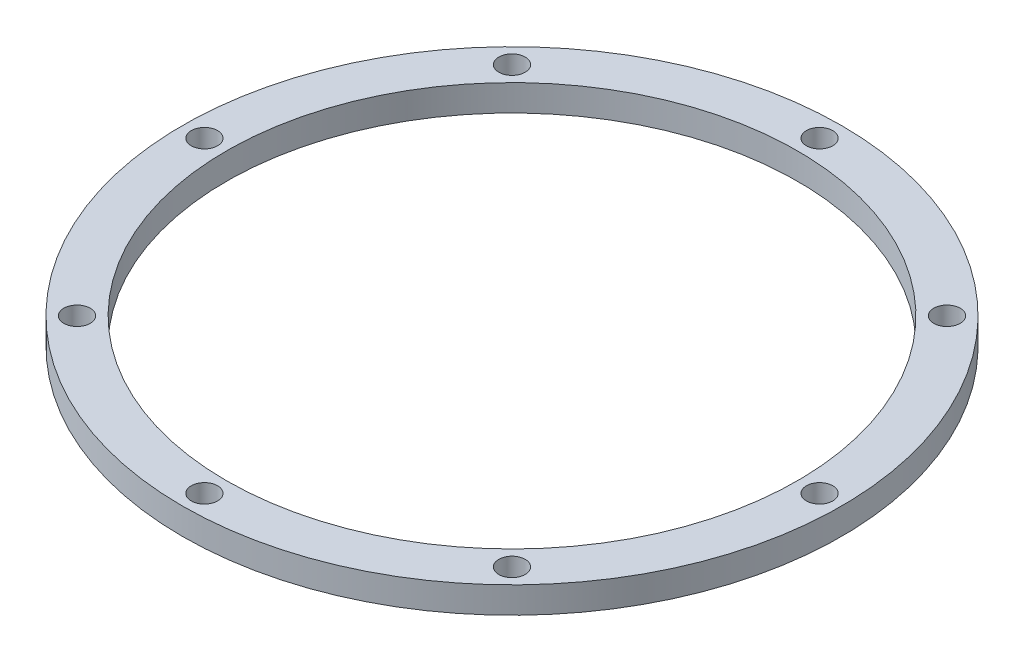
from build123d import *

# Parameters (mm, degrees)
SKETCH_1_R          = 75
EXTRUDE_1_DEPTH     = 6
SKETCH_2_R          = 3
CUT_EXTRUDE_1_DEPTH = 6
SKETCH_3_R          = 65
CUT_EXTRUDE_2_DEPTH = 6


with BuildPart() as part:
    # Эскиз1 → Бобышка-Вытянуть1 (new body)
    with BuildSketch(Plane(origin=(0, 0, 0), x_dir=(1, 0, 0), z_dir=(0, 1, 0))):
        with Locations(Location((0, 0, 0), (0, 0, 270))):
            Circle(SKETCH_1_R)
    extrude(amount=EXTRUDE_1_DEPTH)

    # Эскиз2 → Вырез-Вытянуть1 (cut)
    with BuildSketch(Plane(origin=(0, 6, 0), x_dir=(1, 0, 0), z_dir=(0, 1, 0))):
        with Locations(Location((-70, 0, 0), (0, 0, 270))):
            Circle(SKETCH_2_R)
        with Locations(Location((70, 0, 0), (0, 0, 90))):
            Circle(SKETCH_2_R)
        with Locations(Location((0, -70, 0), (0, 0, 270))):
            Circle(SKETCH_2_R)
        with Locations(Location((0, 70, 0), (0, 0, 90))):
            Circle(SKETCH_2_R)
        with Locations(Location((-49.497474683, -49.497474683, 0), (0, 0, 270))):
            Circle(SKETCH_2_R)
        with Locations(Location((-49.497474683, 49.497474683, 0), (0, 0, 90))):
            Circle(SKETCH_2_R)
        with Locations(Location((49.497474683, -49.497474683, 0), (0, 0, 270))):
            Circle(SKETCH_2_R)
        with Locations(Location((49.497474683, 49.497474683, 0), (0, 0, 90))):
            Circle(SKETCH_2_R)
    extrude(amount=-CUT_EXTRUDE_1_DEPTH, mode=Mode.SUBTRACT)

    # Эскиз3 → Вырез-Вытянуть2 (cut)
    with BuildSketch(Plane(origin=(0, 6, 0), x_dir=(1, 0, 0), z_dir=(0, 1, 0))):
        with Locations(Location((0, 0, 0), (0, 0, 270))):
            Circle(SKETCH_3_R)
    extrude(amount=-CUT_EXTRUDE_2_DEPTH, mode=Mode.SUBTRACT)


solid = part.part
